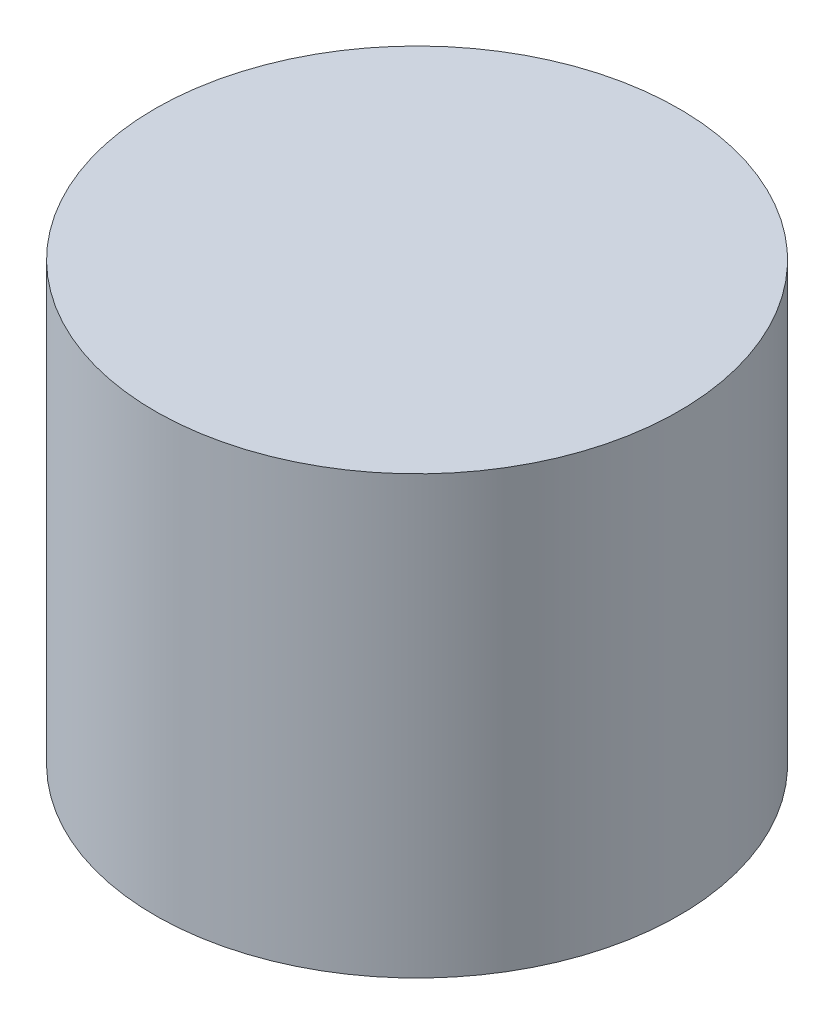
from build123d import *

# Parameters (mm, degrees)
SKETCH1_W = 30
SKETCH1_H = 50


with BuildPart() as part:
    # Sketch1 → Revolve1 (revolve)
    with BuildSketch(Plane.XY):
        with Locations((4.507038004, -16.583177393)):
            Rectangle(SKETCH1_W, SKETCH1_H)
    revolve(axis=Axis((19.507038004, 8.416822607, 0), (0, -1, 0)))


solid = part.part
